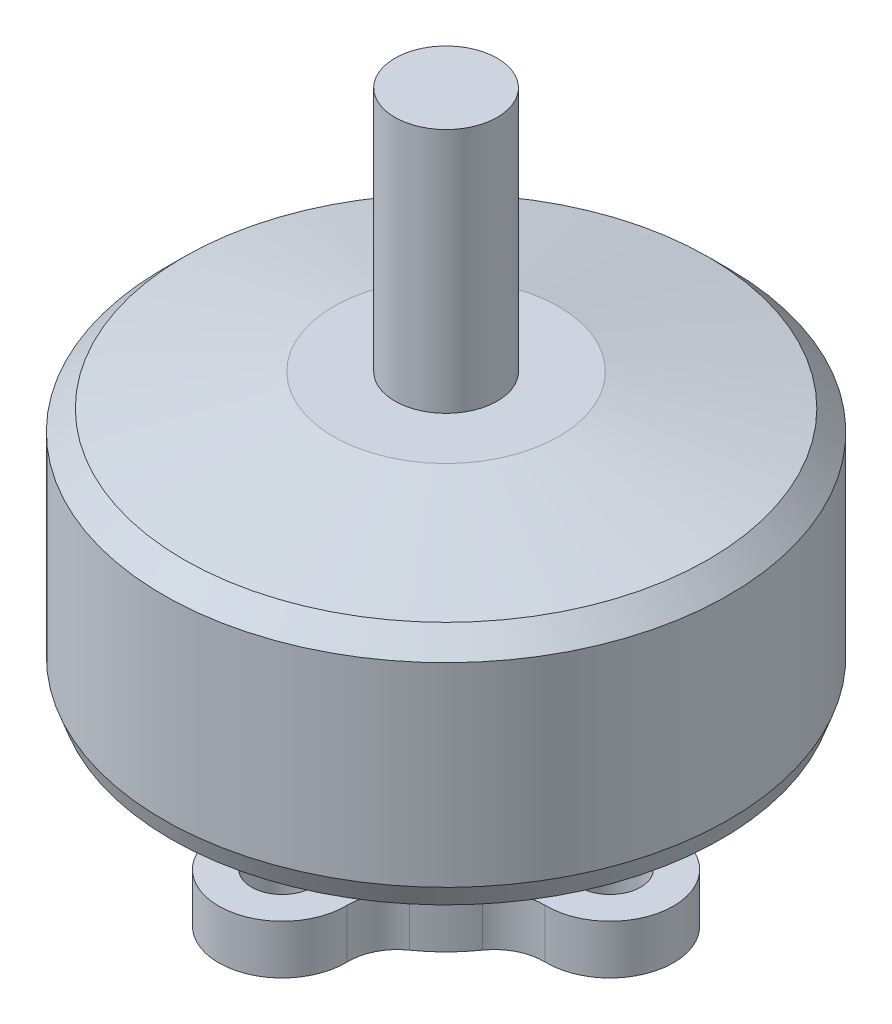
from build123d import *

# Parameters (mm, degrees)
SKETCH2_R          = 12
SKETCH2_R_2        = 1.5
CUT_EXTRUDE1_DEPTH = 35.996892719


with BuildPart() as part:
    # Sketch1 → Revolve1 (revolve)
    with BuildSketch(Plane(origin=(0, 0, 0), x_dir=(0, 0, -1), z_dir=(1, 0, 0))):
        with BuildLine():
            Line((0, 0), (0, 31.45))
            Line((0, 31.45), (-2.5, 31.45))
            Line((-2.5, 31.45), (-2.5, 19.45))
            Line((-2.5, 19.45), (-5.5, 19.45))
            Line((-5.5, 19.45), (-12.8, 17.8983371))
            Line((-12.8, 17.8983371), (-13.8, 16.8983371))
            Line((-13.8, 16.8983371), (-13.8, 7.4))
            Line((-13.8, 7.4), (-13.436029766, 6.4))
            Line((-13.436029766, 6.4), (-5.5, 6.4))
            Line((-5.5, 6.4), (-5.5, 4.4))
            ThreePointArc((-5.5, 4.4), (-5.763932023, 3.281966011), (-6.5, 2.4))
            Line((-6.5, 2.4), (-12, 2.4))
            Line((-12, 2.4), (-12, 0))
            Line((-12, 0), (0, 0))
        make_face()
    revolve(axis=Axis((0, 0, 0), (0, 1, 0)))

    # Sketch2 → Cut-Extrude1 (cut, through all)
    # profile 1 of 5: a face of its own
    with BuildSketch(Plane(origin=(0, 2.4, 0), x_dir=(1, 0, 0), z_dir=(0, 1, 0))):
        Circle(SKETCH2_R)
        with BuildLine():
            ThreePointArc((3.09912558, -7.926375), (0, -11.1), (-3.09912558, -7.926375))
            ThreePointArc((-3.09912558, -7.926375), (-3.357154936, -6.785464761), (-4.123836457, -5.90203125))
            ThreePointArc((-4.123836457, -5.90203125), (-5.091168825, -5.091168825), (-5.90203125, -4.123836457))
            ThreePointArc((-5.90203125, -4.123836457), (-6.785464761, -3.357154936), (-7.926375, -3.09912558))
            ThreePointArc((-7.926375, -3.09912558), (-11.1, 0), (-7.926375, 3.09912558))
            ThreePointArc((-7.926375, 3.09912558), (-6.785464761, 3.357154936), (-5.90203125, 4.123836457))
            ThreePointArc((-5.90203125, 4.123836457), (-5.091168825, 5.091168825), (-4.123836457, 5.90203125))
            ThreePointArc((-4.123836457, 5.90203125), (-3.357154936, 6.785464761), (-3.09912558, 7.926375))
            ThreePointArc((-3.09912558, 7.926375), (0, 11.1), (3.09912558, 7.926375))
            ThreePointArc((3.09912558, 7.926375), (3.357154936, 6.785464761), (4.123836457, 5.90203125))
            ThreePointArc((4.123836457, 5.90203125), (5.091168825, 5.091168825), (5.90203125, 4.123836457))
            ThreePointArc((5.90203125, 4.123836457), (6.785464761, 3.357154936), (7.926375, 3.09912558))
            ThreePointArc((7.926375, 3.09912558), (11.1, 0), (7.926375, -3.09912558))
            ThreePointArc((7.926375, -3.09912558), (6.785464761, -3.357154936), (5.90203125, -4.123836457))
            ThreePointArc((5.90203125, -4.123836457), (5.091168825, -5.091168825), (4.123836457, -5.90203125))
            ThreePointArc((4.123836457, -5.90203125), (3.357154936, -6.785464761), (3.09912558, -7.926375))
        make_face(mode=Mode.SUBTRACT)
    # profile 2 of 5: a face of its own
    with BuildSketch(Plane(origin=(0, 2.4, 0), x_dir=(1, 0, 0), z_dir=(0, 1, 0))):
        with Locations((8, 0)):
            Circle(SKETCH2_R_2)
    # profile 3 of 5: a face of its own
    with BuildSketch(Plane(origin=(0, 2.4, 0), x_dir=(1, 0, 0), z_dir=(0, 1, 0))):
        with Locations((0, 8)):
            Circle(SKETCH2_R_2)
    # profile 4 of 5: a face of its own
    with BuildSketch(Plane(origin=(0, 2.4, 0), x_dir=(1, 0, 0), z_dir=(0, 1, 0))):
        with Locations((-8, 0)):
            Circle(SKETCH2_R_2)
    # profile 5 of 5: a face of its own
    with BuildSketch(Plane(origin=(0, 2.4, 0), x_dir=(1, 0, 0), z_dir=(0, 1, 0))):
        with Locations((0, -8)):
            Circle(SKETCH2_R_2)
    extrude(amount=-CUT_EXTRUDE1_DEPTH, mode=Mode.SUBTRACT)


solid = part.part
